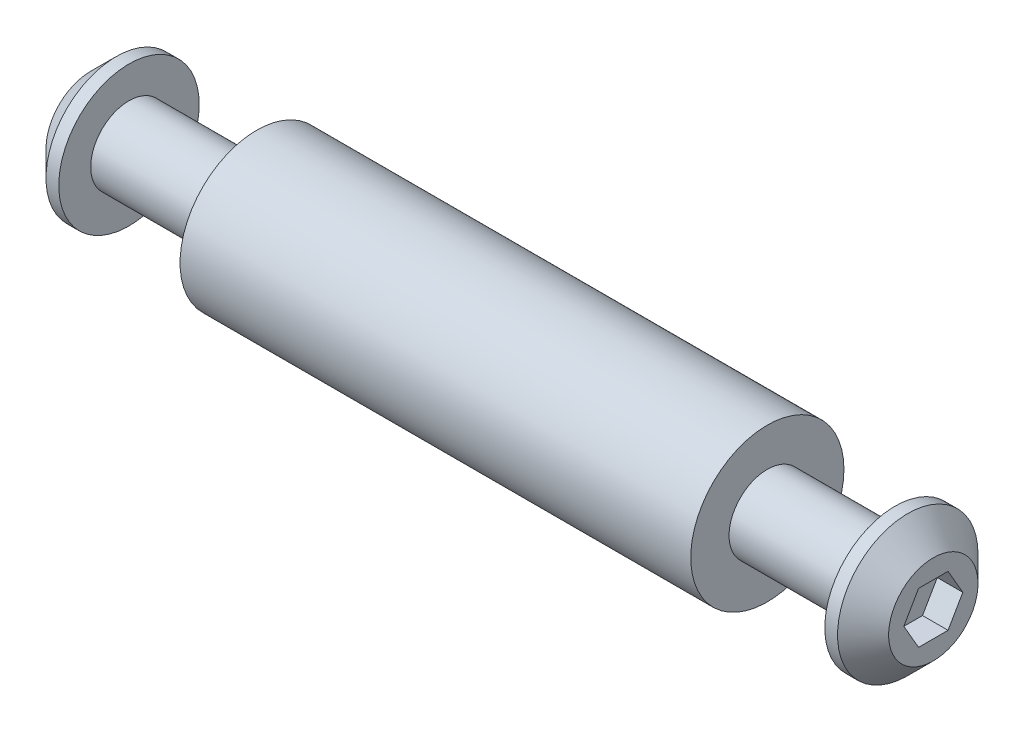
from build123d import *

# Parameters (mm, degrees)
ENL_V_MAT_EXTRU_1_DEPTH = 1


with BuildPart() as part:
    # Esquisse1 → Révolution1 (revolve)
    with BuildSketch(Plane.XY, mode=Mode.PRIVATE) as r_volution1_sk:
        Polygon((10, 3), (-10, 3), (-10, 1.5), (-15, 1.5), (-15, 2.75), (-15.5, 2.75), (-16.5, 1.75), (-16.5, 0), (16.5, 0), (16.5, 1.75), (15.5, 2.75), (15, 2.75), (15, 1.5), (10, 1.5), align=None)
    revolve(r_volution1_sk.sketch.rotate(Axis((0, 0, 0), (-1, 0, 0)), 90), axis=Axis((0, 0, 0), (-1, 0, 0)))

    # Esquisse2 → Enlèv. mat.-Extru.1 (cut)
    with BuildSketch(Plane(origin=(16.5, 0, 0), x_dir=(0, 0, -1), z_dir=(1, 0, 0))):
        Polygon((0.577350269, 1), (-0.577350269, 1), (-1.154700538, 0), (-0.577350269, -1), (0.577350269, -1), (1.154700538, 0), align=None)
    enl_v_mat_extru_1 = extrude(amount=-ENL_V_MAT_EXTRU_1_DEPTH, mode=Mode.SUBTRACT)

    # Symétrie1: Enlèv. mat.-Extru.1 across plane
    add(enl_v_mat_extru_1.mirror(Plane(origin=(0, 0, 0), x_dir=(0, 0, 1), z_dir=(1, 0, 0))), mode=Mode.SUBTRACT)


solid = part.part
